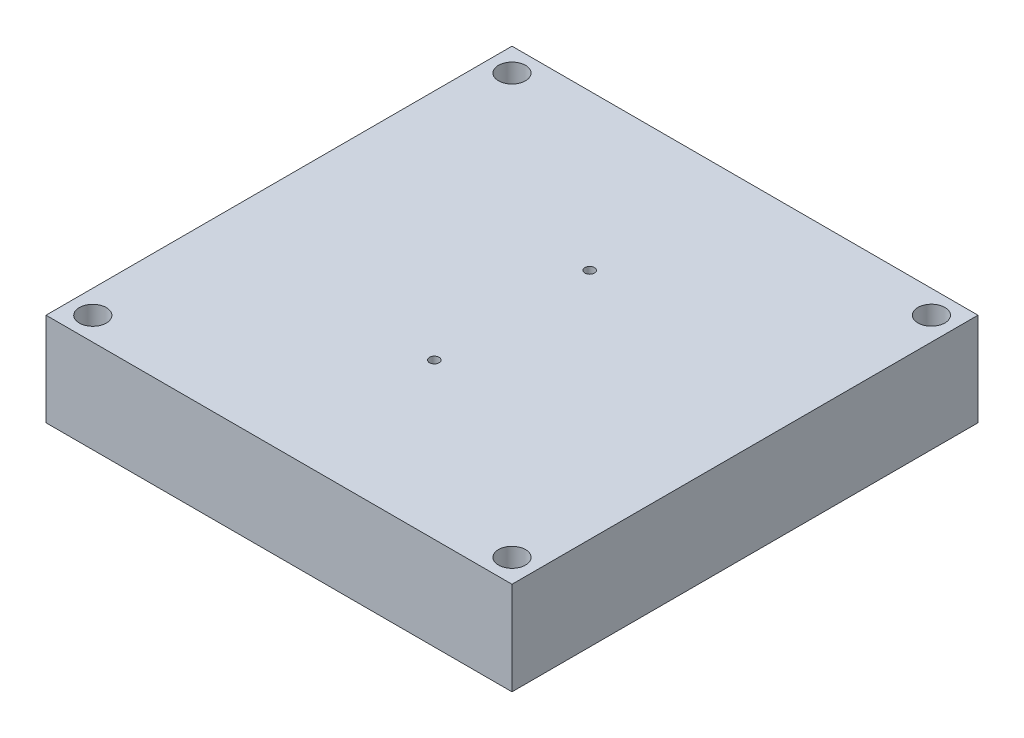
from build123d import *

# Parameters (mm, degrees)
SKETCH1_W                                         = 100
SKETCH1_H                                         = 100
BOSS_EXTRUDE1_DEPTH                               = 20
CSK_FOR_1_FLAT_HEAD_MACHINE_SCREW_100_D           = 2.0574
CSK_FOR_1_FLAT_HEAD_MACHINE_SCREW_100_CSINK_D     = 3.7084
CSK_FOR_1_FLAT_HEAD_MACHINE_SCREW_100_CSINK_ANGLE = 100
F_1_0_228_DIAMETER_HOLE1_D                        = 5.7912


with BuildPart() as part:
    # Sketch1 → Boss-Extrude1 (new body)
    with BuildSketch(Plane(origin=(0, 0, 0), x_dir=(1, 0, 0), z_dir=(0, 1, 0))):
        with Locations((21.428571429, -2.857142857)):
            Rectangle(SKETCH1_W, SKETCH1_H)
    extrude(amount=BOSS_EXTRUDE1_DEPTH)

    # CSK for #1 Flat Head Machine Screw (100)1 (through all)
    with Locations(Plane(origin=(21.428571429, 0, -13.80952381), x_dir=(0, 0, -1), z_dir=(0, -1, 0))):
        with Locations((0, 0), (-33.333333334, 0)):
            CounterSinkHole(CSK_FOR_1_FLAT_HEAD_MACHINE_SCREW_100_D / 2, CSK_FOR_1_FLAT_HEAD_MACHINE_SCREW_100_CSINK_D / 2, counter_sink_angle=CSK_FOR_1_FLAT_HEAD_MACHINE_SCREW_100_CSINK_ANGLE)

    # #1 (0.228) Diameter Hole1 (through all)
    with Locations(Plane(origin=(-23.530488072, 20, 47.857142857), x_dir=(0, 0, 1), z_dir=(0, 1, 0))):
        with Locations((0, 0), (0, 89.959059501), (-90, 89.959059501), (-90, -0.040940499)):
            Hole(F_1_0_228_DIAMETER_HOLE1_D / 2)


solid = part.part
